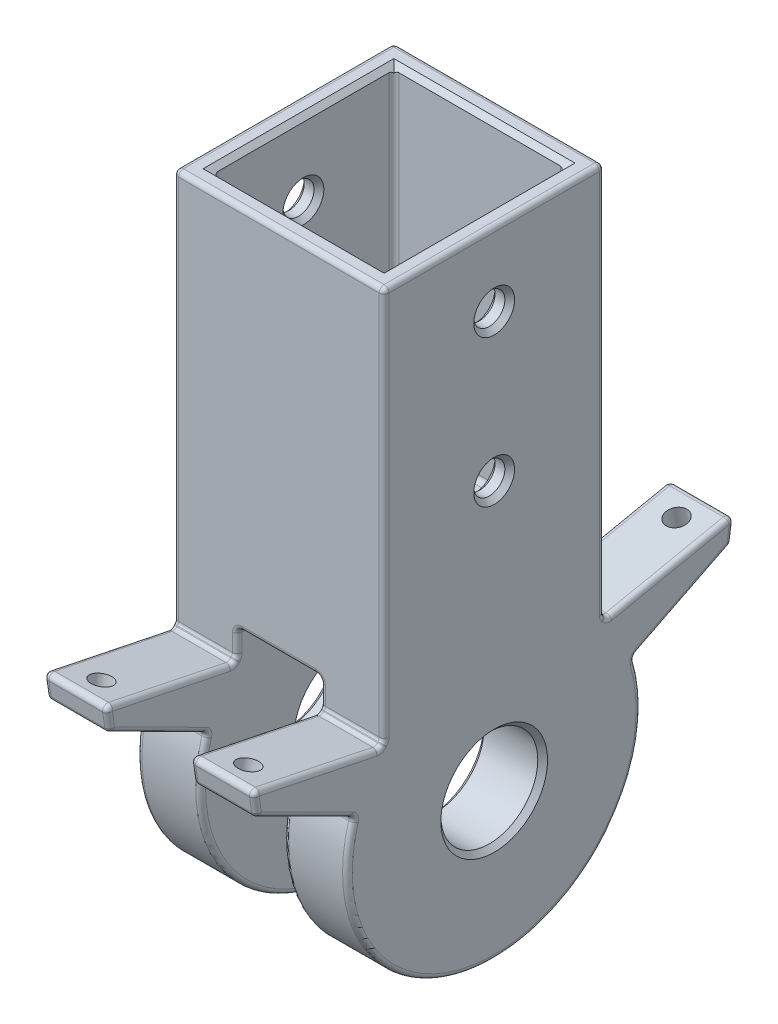
from build123d import *

# Parameters (mm, degrees)
SKETCH1_R               = 9.906
BOSS_EXTRUDE1_DEPTH     = 43
CUT_EXTRUDE1_DEPTH      = 90
CUT_EXTRUDE1_DEPTH_BACK = 90
SKETCH2_W               = 17
SKETCH2_H               = 75
CUT_EXTRUDE2_START      = 17
SKETCH3_R               = 30
CUT_EXTRUDE2_DEPTH      = 17
SKETCH4_R               = 3.175
CUT_EXTRUDE3_DEPTH      = 120.336140756
FILLET1_R               = 1
CHAMFER1_SIZE           = 1
SKETCH6_W               = 35
SKETCH6_H               = 37
CUT_EXTRUDE4_DEPTH      = 65
CHAMFER2_SIZE           = 1
FILLET2_R               = 1
SKETCH8_R               = 2.15
CUT_EXTRUDE6_DEPTH      = 15
LPATTERN1_COUNT         = 2
LPATTERN1_PITCH         = 30
MIRROR1_COPY_1_SKETCH_R = 2.15
MIRROR1_COPY_1_DEPTH    = 15


with BuildPart() as part:
    # Sketch1 → Boss-Extrude1 (new body)
    with BuildSketch(Plane(origin=(0, 0, 0), x_dir=(0, 0, -1), z_dir=(1, 0, 0))):
        with BuildLine():
            Line((23.228679825, 18.98495282), (49.228679825, 24.342487096))
            Line((49.228679825, 24.342487096), (48.502006775, 19.395574293))
            Line((48.502006775, 19.395574293), (28.502006775, 9.361389311))
            ThreePointArc((28.502006775, 9.361389311), (0, -30), (-28.502006775, 9.361389311))
            Line((-28.502006775, 9.361389311), (-48.502006775, 19.395574293))
            Line((-48.502006775, 19.395574293), (-49.228679825, 24.342487096))
            Line((-49.228679825, 24.342487096), (-23.228679825, 18.98495282))
            ThreePointArc((-23.228679825, 18.98495282), (-22.868365895, 19.417462277), (-22.5, 19.843134833))
            Line((-22.5, 19.843134833), (-22.5, 99.843134833))
            Line((-22.5, 99.843134833), (22.5, 99.843134833))
            Line((22.5, 99.843134833), (22.5, 19.843134833))
            ThreePointArc((22.5, 19.843134833), (22.868365895, 19.417462277), (23.228679825, 18.98495282))
        make_face()
        Circle(SKETCH1_R, mode=Mode.SUBTRACT)
    extrude(amount=BOSS_EXTRUDE1_DEPTH)

    # Sketch2 → Cut-Extrude1 (cut, two sides: drawn at the far end of the back side and taken through both)
    with BuildSketch(Plane.XY.offset(-CUT_EXTRUDE1_DEPTH_BACK)):
        with Locations((21.5, -12.656865167)):
            Rectangle(SKETCH2_W, SKETCH2_H)
    extrude(amount=CUT_EXTRUDE1_DEPTH + CUT_EXTRUDE1_DEPTH_BACK, mode=Mode.SUBTRACT)

    # Sketch3 → Cut-Extrude2 (cut)
    with BuildSketch(Plane.ZY.offset(-30).offset(CUT_EXTRUDE2_START)):
        Circle(SKETCH3_R)
    extrude(amount=-CUT_EXTRUDE2_DEPTH, mode=Mode.SUBTRACT)

    # Sketch4 → Cut-Extrude3 (cut, through all)
    with BuildSketch(Plane(origin=(43, 0, 0), x_dir=(0, 0, -1), z_dir=(1, 0, 0))):
        with Locations((0, 54.843134833)):
            Circle(SKETCH4_R)
        with Locations((0, 84.843134833)):
            Circle(SKETCH4_R)
    extrude(amount=-CUT_EXTRUDE3_DEPTH, mode=Mode.SUBTRACT)

    # Fillet1
    fillet1_edges = [part.edges().sort_by_distance(p)[0] for p in [
        (0, 21.663719958, -36.228679825),
        (0, 21.869030694, -48.8653433),
        (43, 99.843134833, 0),
        (0, 14.378481802, -38.502006775),
        (0, -30, 0),
        (0, 14.378481802, 38.502006775),
        (0, 21.869030694, 48.8653433),
        (0, 21.663719958, 36.228679825),
        (0, 19.417462277, 22.868365895),
        (0, 59.843134833, 22.5),
        (0, 99.843134833, 0),
        (0, 59.843134833, -22.5),
        (0, 19.417462277, -22.868365895),
        (43, 59.843134833, 22.5),
        (36.5, 18.98495282, -23.228679825),
        (36.5, 24.342487096, -49.228679825),
        (36.5, 19.395574293, -48.502006775),
        (43, 19.417462277, 22.868365895),
        (36.5, 9.361389311, -28.502006775),
        (36.5, 9.361389311, 28.502006775),
        (36.5, 19.395574293, 48.502006775),
        (36.5, 24.342487096, 49.228679825),
        (36.5, 18.98495282, 23.228679825),
        (36.5, 19.843134833, 22.5),
        (21.5, 99.843134833, 22.5),
        (21.5, 99.843134833, -22.5),
        (36.5, 19.843134833, -22.5),
        (43, 21.663719958, 36.228679825),
        (43, 21.869030694, 48.8653433),
        (43, 14.378481802, 38.502006775),
        (43, -30, 0),
        (6.5, 18.98495282, -23.228679825),
        (6.5, 24.342487096, -49.228679825),
        (43, 14.378481802, -38.502006775),
        (6.5, 19.395574293, -48.502006775),
        (6.5, 9.361389311, -28.502006775),
        (6.5, 9.361389311, 28.502006775),
        (43, 21.869030694, -48.8653433),
        (6.5, 19.395574293, 48.502006775),
        (6.5, 24.342487096, 49.228679825),
        (43, 21.663719958, -36.228679825),
        (6.5, 18.98495282, 23.228679825),
        (43, 19.417462277, -22.868365895),
        (6.5, 19.843134833, 22.5),
        (21.5, 24.843134833, 22.5),
        (6.5, 19.843134833, -22.5),
        (21.5, 24.843134833, -22.5),
        (13, 24.843134833, -19.658606479),
        (30, 24.843134833, -19.658606479),
        (13, 22.343134833, -22.5),
        (13, 19.417462277, -22.868365895),
        (13, 21.663719958, -36.228679825),
        (13, 21.869030694, -48.8653433),
        (13, 14.378481802, -38.502006775),
        (13, -30, 0),
        (13, 14.378481802, 38.502006775),
        (13, 21.869030694, 48.8653433),
        (13, 21.663719958, 36.228679825),
        (13, 19.417462277, 22.868365895),
        (13, 22.343134833, 22.5),
        (30, 22.343134833, -22.5),
        (30, 19.417462277, -22.868365895),
        (30, 21.663719958, -36.228679825),
        (30, 21.869030694, -48.8653433),
        (30, 14.378481802, -38.502006775),
        (30, -30, 0),
        (30, 14.378481802, 38.502006775),
        (30, 21.869030694, 48.8653433),
        (30, 21.663719958, 36.228679825),
        (30, 19.417462277, 22.868365895),
        (30, 22.343134833, 22.5),
        (13, 24.843134833, 19.658606479),
        (30, 24.843134833, 19.658606479),
        (13, 30, 0),
        (30, 30, 0),
        (21.5, 24.843134833, 16.817212958),
        (21.5, 24.843134833, -16.817212958),
        (43, 59.843134833, -22.5),
    ]]
    fillet(fillet1_edges, radius=FILLET1_R)

    # Chamfer1
    chamfer1_edges = [part.edges().sort_by_distance(p)[0] for p in [
        (0, 84.843134833, 3.175),
        (43, 84.843134833, 3.175),
        (0, 54.843134833, 3.175),
        (43, 54.843134833, 3.175),
        (0, 0, 9.906),
        (43, 0, 9.906),
        (30, 0, 9.906),
        (13, 0, 9.906),
    ]]
    chamfer(chamfer1_edges, length=CHAMFER1_SIZE)

    # Sketch6 → Cut-Extrude4 (cut)
    with BuildSketch(Plane(origin=(0, 99.843134833, 0), x_dir=(1, 0, 0), z_dir=(0, 1, 0))):
        with Locations((21.5, 0)):
            Rectangle(SKETCH6_W, SKETCH6_H)
    extrude(amount=-CUT_EXTRUDE4_DEPTH, mode=Mode.SUBTRACT)

    # Chamfer2
    chamfer2_edges = [part.edges().sort_by_distance(p)[0] for p in [
        (4, 84.843134833, 3.175),
        (4, 54.843134833, 3.175),
        (39, 84.843134833, 3.175),
        (39, 54.843134833, 3.175),
        (21.5, 99.843134833, 18.5),
        (39, 99.843134833, 0),
        (21.5, 99.843134833, -18.5),
        (4, 99.843134833, 0),
    ]]
    chamfer(chamfer2_edges, length=CHAMFER2_SIZE)

    # Fillet2
    fillet2_edges = [part.edges().sort_by_distance(p)[0] for p in [
        (4, 34.843134833, 0),
        (4, 66.843134833, 18.5),
        (39, 34.843134833, 0),
        (39, 66.843134833, -18.5),
        (21.5, 34.843134833, 18.5),
        (39, 66.843134833, 18.5),
        (21.5, 34.843134833, -18.5),
        (4, 66.843134833, -18.5),
    ]]
    fillet(fillet2_edges, radius=FILLET2_R)

    # Sketch8 → Cut-Extrude6 (cut)
    with BuildSketch(Plane(origin=(0, 13.620157835, 2.806556248), x_dir=(1, 0, 0), z_dir=(0, 0.979422855445958, 0.20181890454089335))):
        with Locations(Location((36.5, 47.550320237, 0), (0, 0, 270))):
            Circle(SKETCH8_R)
    cut_extrude6 = extrude(amount=-CUT_EXTRUDE6_DEPTH, mode=Mode.SUBTRACT)

    # LPattern1: Cut-Extrude6 ×2
    with Locations(*[(-i * LPATTERN1_PITCH, 0, 0) for i in range(1, LPATTERN1_COUNT)]):
        add(cut_extrude6, mode=Mode.SUBTRACT)

    # Mirror1: Cut-Extrude6 across plane
    add(cut_extrude6.mirror(Plane.XY), mode=Mode.SUBTRACT)

    # Mirror1 copy 1 sketch → Mirror1 copy 1 (cut)
    with BuildSketch(Plane(origin=(-30, 13.620157835, -2.806556248), x_dir=(1, 0, 0), z_dir=(0, 0.979422855445958, -0.20181890454089335))):
        with Locations((36.5, -47.550320237)):
            Circle(MIRROR1_COPY_1_SKETCH_R)
    extrude(amount=-MIRROR1_COPY_1_DEPTH, mode=Mode.SUBTRACT)


solid = part.part
